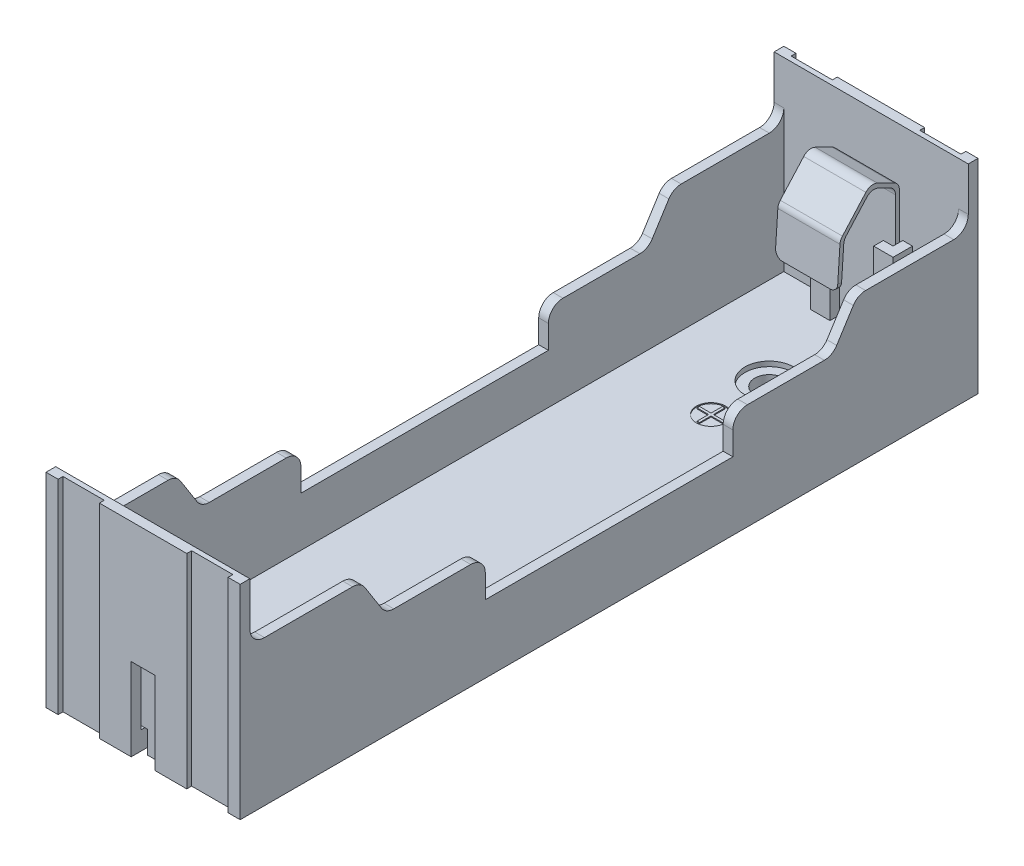
from build123d import *

# Parameters (mm, degrees)
SKETCH_1_W                  = 20
SKETCH_1_H                  = 76
EXTRUDE_741_DEPTH           = 21
CUT_EXTRUDE_1856_DEPTH      = 45.55333882
SKETCH_3_W                  = 18
SKETCH_3_H                  = 74
CUT_EXTRUDE_2417_DEPTH      = 19.1
CUT_EXTRUDE_2709_DEPTH      = 15
CUT_EXTRUDE_2709_DEPTH_BACK = 15
SKETCH_4_W                  = 74
SKETCH_4_H                  = 12
CUT_EXTRUDE_3308_DEPTH      = 15
FILLET_2_R                  = 1.5
FILLET_2_OF_MIRROR_2_R      = 1.5
SKETCH_6_W                  = 2.45
SKETCH_6_H                  = 7
CUT_EXTRUDE_4432_DEPTH      = 8.5
SKETCH_11_R                 = 1.5
CUT_EXTRUDE_4895_DEPTH      = 45.55333882
EXTRUDE_START               = -0.3
SKETCH_12_R                 = 2.8
SKETCH_12_R_2               = 1.5
EXTRUDE_5316_DEPTH          = 0.3
CUT_EXTRUDE_START           = -0.5
SKETCH_13_R                 = 2.5
SKETCH_13_R_2               = 1.5
CUT_EXTRUDE_17_DEPTH        = 0.5
SKETCH_14_R                 = 1.5
SKETCH_14_W                 = 0.25
SKETCH_14_H                 = 2.6
CUT_EXTRUDE_8215_DEPTH      = 0.1
EXTRUDE_9593_DEPTH          = 8.9
EXTRUDE_10440_DEPTH         = 3.2
SKETCH_17_W                 = 1.7
SKETCH_17_H                 = 0.4
EXTRUDE_10892_DEPTH         = 5.5
FILLET_3_R                  = 1
FILLET_4_R                  = 0.75
SKETCH_18_W                 = 1.783491242
SKETCH_18_H                 = 3.330988095
CUT_EXTRUDE_18_DEPTH        = 80.47955712


with BuildPart() as part:
    # Эскиз1 → Extrude 741 (new body)
    with BuildSketch(Plane(origin=(0, 0, 0), x_dir=(1, 0, 0), z_dir=(0, 1, 0))):
        Rectangle(SKETCH_1_W, SKETCH_1_H)
    extrude(amount=EXTRUDE_741_DEPTH)

    # Эскиз2 → Cut-Extrude 1856 (cut, through all)
    with BuildSketch(Plane(origin=(0, 0, 0), x_dir=(1, 0, 0), z_dir=(0, 1, 0))):
        Polygon((-4.5, 37.5), (-4.5, 38), (4.5, 38), (4.5, 37.5), (8.75, 37.5), (8.75, 38), (10, 38), (10, 46.507054696), (-10, 46.507054696), (-10, 38), (-8.75, 38), (-8.75, 37.5), align=None)
    cut_extrude_1856 = extrude(amount=CUT_EXTRUDE_1856_DEPTH, mode=Mode.SUBTRACT)

    # Зеркальное отражение1: Cut-Extrude 1856 across plane
    add(cut_extrude_1856.mirror(Plane.XY), mode=Mode.SUBTRACT)

    # Эскиз3 → Cut-Extrude 2417 (cut)
    with BuildSketch(Plane(origin=(0, 21, 0), x_dir=(1, 0, 0), z_dir=(0, 1, 0))):
        Rectangle(SKETCH_3_W, SKETCH_3_H)
    extrude(amount=-CUT_EXTRUDE_2417_DEPTH, mode=Mode.SUBTRACT)

    # Эскиз4 → Cut-Extrude 2709 (cut, two sides: drawn at the far end of the back side and taken through both)
    with BuildSketch(Plane(origin=(0, 0, 0), x_dir=(0, 0, -1), z_dir=(1, 0, 0)).offset(-CUT_EXTRUDE_2709_DEPTH_BACK)):
        with Locations((0, 21)):
            Rectangle(SKETCH_4_W, SKETCH_4_H)
    extrude(amount=CUT_EXTRUDE_2709_DEPTH + CUT_EXTRUDE_2709_DEPTH_BACK, mode=Mode.SUBTRACT)

    # Эскиз5 → Cut-Extrude 3308 (cut)
    with BuildSketch(Plane(origin=(10, 0, 0), x_dir=(0, 0, -1), z_dir=(1, 0, 0))):
        Polygon((35.6, 21), (-35.6, 21), (-35.6, 15), (-25.6, 15), (-23, 10.9), (-12.75, 10.9), (-12.75, 7), (12.75, 7), (12.75, 10.9), (23, 10.9), (25.6, 15), (35.6, 15), align=None)
    cut_extrude_3308 = extrude(amount=-CUT_EXTRUDE_3308_DEPTH, mode=Mode.SUBTRACT)

    # Скругление2
    fillet_2_edges = [part.edges().sort_by_distance(p)[0] for p in [
        (9.5, 10.9, -23),
        (9.5, 10.9, -12.75),
        (9.5, 10.9, 12.75),
        (9.5, 10.9, 23),
        (9.5, 15, -37),
        (9.5, 15, -25.6),
        (9.5, 15, 37),
        (9.5, 15, 25.6),
    ]]
    fillet(fillet_2_edges, radius=FILLET_2_R)

    # Зеркальное отражение2: Cut-Extrude 3308 across plane
    add(cut_extrude_3308.mirror(Plane(origin=(0, 0, 0), x_dir=(0, 0, 1), z_dir=(1, 0, 0))), mode=Mode.SUBTRACT)

    # Скругление2 of Зеркальное отражение2
    fillet_2_of_mirror_2_edges = [part.edges().sort_by_distance(p)[0] for p in [
        (-9.5, 10.9, -23),
        (-9.5, 10.9, -12.75),
        (-9.5, 10.9, 12.75),
        (-9.5, 10.9, 23),
        (-9.5, 15, -37),
        (-9.5, 15, -25.6),
        (-9.5, 15, 37),
        (-9.5, 15, 25.6),
    ]]
    fillet(fillet_2_of_mirror_2_edges, radius=FILLET_2_OF_MIRROR_2_R)

    # Эскиз6 → Cut-Extrude 4432 (cut)
    with BuildSketch(Plane(origin=(0, 0, 0), x_dir=(1, 0, 0), z_dir=(0, 1, 0))):
        with Locations((0, -38)):
            Rectangle(SKETCH_6_W, SKETCH_6_H)
        with Locations((0, 38)):
            Rectangle(SKETCH_6_W, SKETCH_6_H)
    extrude(amount=CUT_EXTRUDE_4432_DEPTH, mode=Mode.SUBTRACT)

    # Эскиз11 → Cut-Extrude 4895 (cut, through all)
    with BuildSketch(Plane(origin=(0, 0, 0), x_dir=(1, 0, 0), z_dir=(0, 1, 0))):
        with Locations((0, 26.5)):
            Circle(SKETCH_11_R)
        with Locations((0, -26.5)):
            Circle(SKETCH_11_R)
    extrude(amount=CUT_EXTRUDE_4895_DEPTH, mode=Mode.SUBTRACT)

    # Эскиз12 → Extrude 5316 (add)
    # profile 1 of 2: a face of its own
    with BuildSketch(Plane(origin=(0, 0, 0), x_dir=(1, 0, 0), z_dir=(0, 1, 0)).offset(EXTRUDE_START)):
        with Locations((0, 26.5)):
            Circle(SKETCH_12_R)
        with Locations((0, 26.5)):
            Circle(SKETCH_12_R_2, mode=Mode.SUBTRACT)
    # profile 2 of 2: a face of its own
    with BuildSketch(Plane(origin=(0, 0, 0), x_dir=(1, 0, 0), z_dir=(0, 1, 0)).offset(EXTRUDE_START)):
        with Locations((0, -26.5)):
            Circle(SKETCH_12_R)
        with Locations((0, -26.5)):
            Circle(SKETCH_12_R_2, mode=Mode.SUBTRACT)
    extrude(amount=EXTRUDE_5316_DEPTH)

    # Эскиз13 → Вырез-Вытянуть17 (cut)
    # profile 1 of 2: a face of its own
    with BuildSketch(Plane(origin=(0, 1.9, 0), x_dir=(1, 0, 0), z_dir=(0, 1, 0)).offset(CUT_EXTRUDE_START)):
        with Locations((0, -26.5)):
            Circle(SKETCH_13_R)
        with Locations((0, -26.5)):
            Circle(SKETCH_13_R_2, mode=Mode.SUBTRACT)
    # profile 2 of 2: a face of its own
    with BuildSketch(Plane(origin=(0, 1.9, 0), x_dir=(1, 0, 0), z_dir=(0, 1, 0)).offset(CUT_EXTRUDE_START)):
        with Locations((0, 26.5)):
            Circle(SKETCH_13_R)
        with Locations((0, 26.5)):
            Circle(SKETCH_13_R_2, mode=Mode.SUBTRACT)
    extrude(amount=CUT_EXTRUDE_17_DEPTH, mode=Mode.SUBTRACT)

    # Эскиз14 → Cut-Extrude 8215 (cut)
    # profile 1 of 2: a face of its own
    with BuildSketch(Plane(origin=(0, 1.9, 0), x_dir=(1, 0, 0), z_dir=(0, 1, 0))):
        with Locations((0, 20.5)):
            Circle(SKETCH_14_R)
        Polygon((-0.125, 21.8), (0.125, 21.8), (0.125, 20.625), (1.3, 20.625), (1.3, 20.375), (0.125, 20.375), (0.125, 19.2), (-0.125, 19.2), (-0.125, 20.375), (-1.3, 20.375), (-1.3, 20.625), (-0.125, 20.625), align=None, mode=Mode.SUBTRACT)
    # profile 2 of 2: a face of its own
    with BuildSketch(Plane(origin=(0, 1.9, 0), x_dir=(1, 0, 0), z_dir=(0, 1, 0))):
        with Locations((0, -20.5)):
            Circle(SKETCH_14_R)
        with Locations((0, -20.5)):
            Rectangle(SKETCH_14_W, SKETCH_14_H, mode=Mode.SUBTRACT)
    extrude(amount=-CUT_EXTRUDE_8215_DEPTH, mode=Mode.SUBTRACT)

    # Эскиз15 → Extrude 9593 (add)
    with BuildSketch(Plane(origin=(0, 1.9, 0), x_dir=(1, 0, 0), z_dir=(0, 1, 0))):
        Polygon((-2.25, 35), (-4.25, 35), (-4.25, 37), (-3.25, 37), (-3.25, 36), (-2.25, 36), align=None)
        Polygon((2.25, 35), (2.25, 36), (3.25, 36), (3.25, 37), (4.25, 37), (4.25, 35), align=None)
        Polygon((4.25, -35), (2.25, -35), (2.25, -36), (3.25, -36), (3.25, -37), (4.25, -37), align=None)
        Polygon((-2.25, -36), (-2.25, -35), (-4.25, -35), (-4.25, -37), (-3.25, -37), (-3.25, -36), align=None)
    extrude(amount=EXTRUDE_9593_DEPTH)


with BuildPart() as body_2:
    # Эскиз16 → Extrude 10440 (new, symmetric)
    with BuildSketch(Plane.ZY):
        Polygon((-36.3, 2), (-36.3, 15.826972516), (-33.848539634, 17.01426896), (-30.994965619, 13.823876222), (-30.699555061, 9.402575836), (-30.300444939, 9.429242503), (-30.605034381, 13.987919845), (-33.751460366, 17.50573104), (-36.7, 16.077688118), (-36.7, 2), align=None)
    extrude(amount=EXTRUDE_10440_DEPTH, both=True)

    # Эскиз17 → Extrude 10892 (add)
    with BuildSketch(Plane.XZ.offset(-2)):
        with Locations((0, -36.5)):
            Rectangle(SKETCH_17_W, SKETCH_17_H)
    extrude(amount=EXTRUDE_10892_DEPTH)

    # Скругление3
    fillet_3_edges = [body_2.edges().sort_by_distance(p)[0] for p in [
        (0, 13.823876222, -30.994965619),
        (0, 13.987919845, -30.605034381),
        (0, 17.01426896, -33.848539634),
        (0, 17.50573104, -33.751460366),
        (0, 15.826972516, -36.3),
        (0, 16.077688118, -36.7),
    ]]
    fillet(fillet_3_edges, radius=FILLET_3_R)

    # Скругление4
    fillet_4_edges = [body_2.edges().sort_by_distance(p)[0] for p in [
        (3.2, 2, -36.5),
        (0.85, -3.5, -36.5),
        (-0.85, -3.5, -36.5),
        (-3.2, 2, -36.5),
        (3.2, 9.41590917, -30.5),
        (-3.2, 9.41590917, -30.5),
    ]]
    fillet(fillet_4_edges, radius=FILLET_4_R)


with BuildPart() as body_3:
    # Mirror1: mirrored copy
    add(body_2.part.mirror(Plane.XY))


with BuildPart() as cut_extrude_18_tool:
    # Эскиз18 → Вырез-Вытянуть18 (new, through all)
    with BuildSketch(Plane.XY.offset(38)):
        with Locations((0.041745621, -1.976064404)):
            Rectangle(SKETCH_18_W, SKETCH_18_H)
    extrude(amount=-CUT_EXTRUDE_18_DEPTH)


with BuildPart() as body_2_1:
    add(body_2.part)

    # Вырез-Вытянуть18: cut by cut_extrude_18_tool
    add(cut_extrude_18_tool.part, mode=Mode.SUBTRACT)


with BuildPart() as body_3_1:
    add(body_3.part)

    # Вырез-Вытянуть18: cut by cut_extrude_18_tool
    add(cut_extrude_18_tool.part, mode=Mode.SUBTRACT)


solid = Compound([part.part, body_2_1.part, body_3_1.part])
